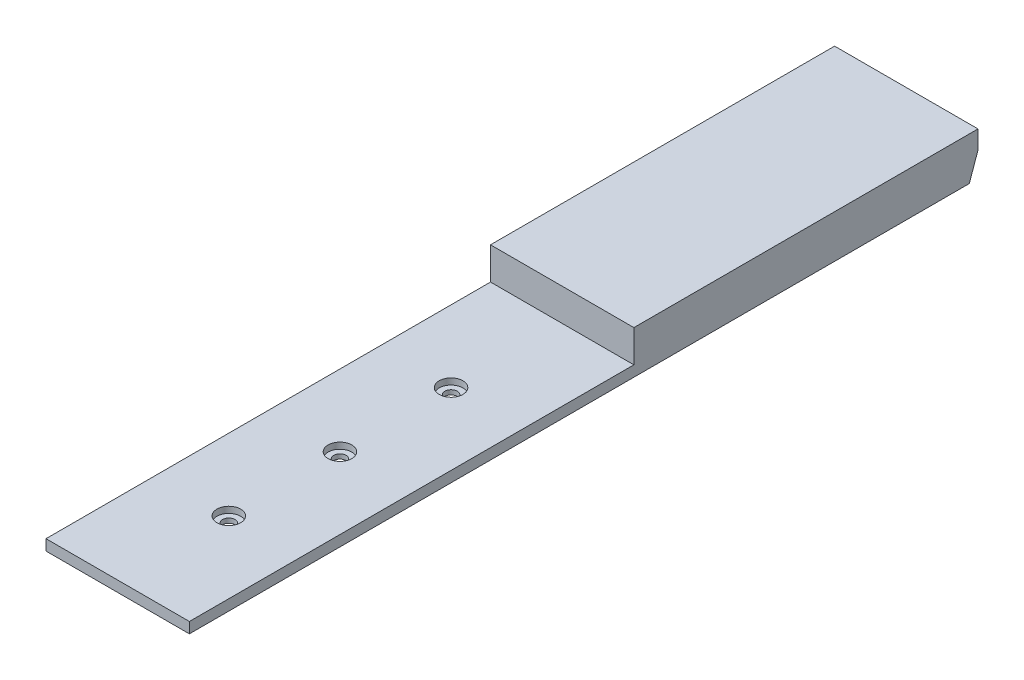
from build123d import *

# Parameters (mm, degrees)
SKETCH1_W                       = 63.5
SKETCH1_H                       = 19.05
BOSS_EXTRUDE1_DEPTH             = 349.25
SKETCH3_W                       = 196.85
SKETCH3_H                       = 14.2875
CUT_EXTRUDE1_DEPTH              = 356.486589058
CUT_EXTRUDE2_DEPTH              = 356.486589058
CBORE_FOR_M5_SBHCS1_D           = 5.5
CBORE_FOR_M5_SBHCS1_CBORE_D     = 10.5
CBORE_FOR_M5_SBHCS1_CBORE_DEPTH = 2.75


with BuildPart() as part:
    # Sketch1 → Boss-Extrude1 (new body)
    with BuildSketch(Plane.XY):
        with Locations((0, 9.525)):
            Rectangle(SKETCH1_W, SKETCH1_H)
    extrude(amount=BOSS_EXTRUDE1_DEPTH)

    # Sketch3 → Cut-Extrude1 (cut, through all)
    with BuildSketch(Plane(origin=(31.75, 0, 0), x_dir=(0, 0, -1), z_dir=(1, 0, 0))):
        with Locations((-250.825, 11.90625)):
            Rectangle(SKETCH3_W, SKETCH3_H)
    extrude(amount=-CUT_EXTRUDE1_DEPTH, mode=Mode.SUBTRACT)

    # Sketch14 → Cut-Extrude2 (cut, through all)
    with BuildSketch(Plane(origin=(31.75, 0, 0), x_dir=(0, 0, -1), z_dir=(1, 0, 0))):
        Polygon((-3.863258779, 0), (0, 0), (0, 10.924113624), align=None)
    extrude(amount=-CUT_EXTRUDE2_DEPTH, mode=Mode.SUBTRACT)

    # CBORE for M5 SBHCS1 (through all)
    with Locations(Plane(origin=(0, 4.7625, 0), x_dir=(1, 0, 0), z_dir=(0, 1, 0))):
        with Locations((0, -201.6125), (0, -250.825), (0, -300.0375)):
            CounterBoreHole(CBORE_FOR_M5_SBHCS1_D / 2, CBORE_FOR_M5_SBHCS1_CBORE_D / 2, CBORE_FOR_M5_SBHCS1_CBORE_DEPTH)


solid = part.part
